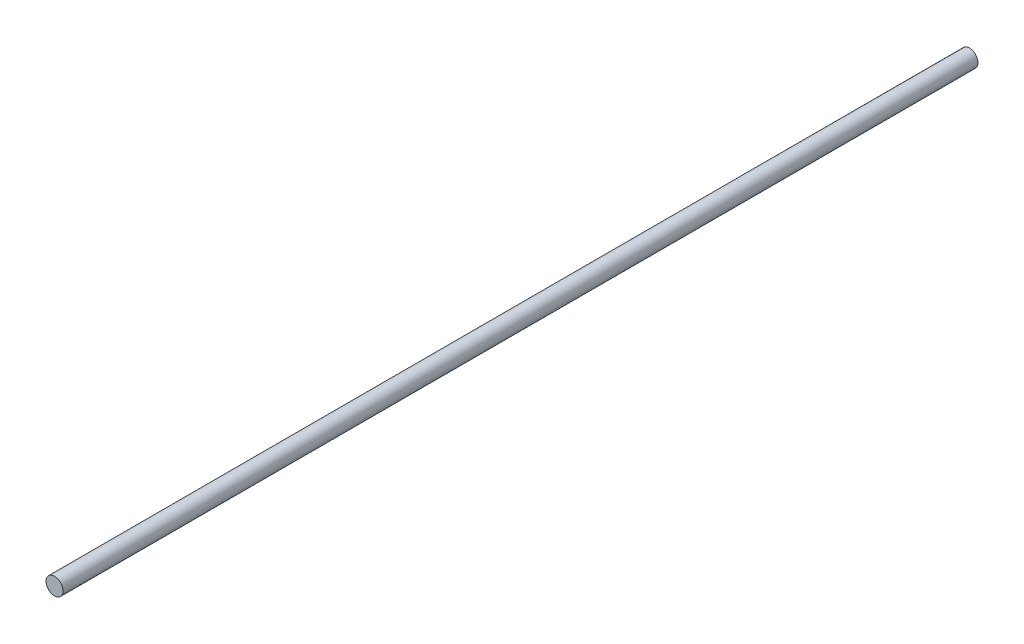
from build123d import *

# Parameters (mm, degrees)
ESBO_O1_R                = 4
RESSALTO_EXTRUS_O1_DEPTH = 430


with BuildPart() as part:
    # Esboço1 → Ressalto-extrusão1 (new body)
    with BuildSketch(Plane.XY):
        Circle(ESBO_O1_R)
    extrude(amount=RESSALTO_EXTRUS_O1_DEPTH)


solid = part.part
